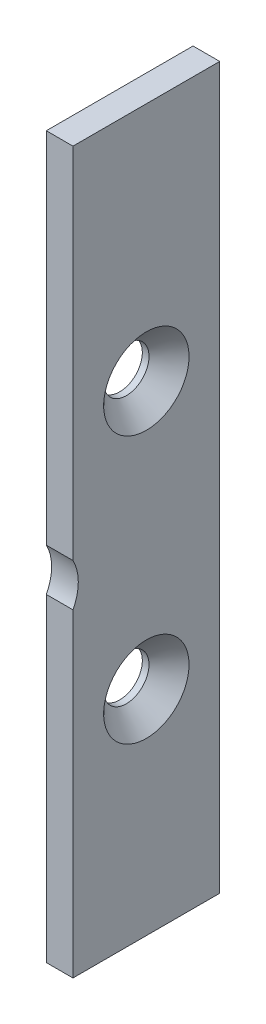
from build123d import *

# Parameters (mm, degrees)
END_STOP_SHEET_SKETCH_W                   = 2
END_STOP_SHEET_SKETCH_H                   = 54
END_STOP_SHEET_DEPTH                      = 11
SCREW_END_CLEARANCE_SKETCH_R              = 3.4
SCREW_END_CLEARANCE_DEPTH                 = 2.2
M3_COUNTERSUNK_CLEARANCE_1_BORE_PROFILE_R = 1.7
M3_COUNTERSUNK_CLEARANCE_1_BORE_DEPTH     = 2.2
M3_COUNTERSUNK_CLEARANCE_2_BORE_PROFILE_R = 1.7
M3_COUNTERSUNK_CLEARANCE_2_BORE_DEPTH     = 2.2


with BuildPart() as part:
    # End stop sheet sketch → End stop sheet (new body)
    with BuildSketch(Plane.XY.offset(-33.5)):
        with Locations((59.2, -27.5)):
            Rectangle(END_STOP_SHEET_SKETCH_W, END_STOP_SHEET_SKETCH_H)
    extrude(amount=END_STOP_SHEET_DEPTH)

    # Screw end clearance sketch → Screw end clearance (cut)
    with BuildSketch(Plane(origin=(58.1, 0, 0), x_dir=(0, 0, -1), z_dir=(1, 0, 0))):
        with Locations((19.5, -29)):
            Circle(SCREW_END_CLEARANCE_SKETCH_R)
    extrude(amount=SCREW_END_CLEARANCE_DEPTH, mode=Mode.SUBTRACT)

    # M3 countersunk clearance 1 bore profile → M3 countersunk clearance 1 bore (cut)
    with BuildSketch(Plane.ZY.offset(-60.2)):
        with Locations(Location((-28, -18.5, 0), (0, 0, 180))):
            Circle(M3_COUNTERSUNK_CLEARANCE_1_BORE_PROFILE_R)
    extrude(amount=M3_COUNTERSUNK_CLEARANCE_1_BORE_DEPTH, mode=Mode.SUBTRACT)

    # M3 countersunk clearance 1 countersink p → M3 countersunk clearance 1 countersink (revolve, cut)
    with BuildSketch(Plane.XY.offset(-28), mode=Mode.PRIVATE) as m3_countersunk_clearance_1_countersink_sk:
        Polygon((60.2, -18.5), (60.2, -15.3), (58.7, -16.8), (58.7, -18.5), align=None)
    revolve(m3_countersunk_clearance_1_countersink_sk.sketch.rotate(Axis((70.2, -18.5, -28), (-1, 0, 0)), 90), axis=Axis((70.2, -18.5, -28), (-1, 0, 0)), mode=Mode.SUBTRACT)

    # M3 countersunk clearance 2 bore profile → M3 countersunk clearance 2 bore (cut)
    with BuildSketch(Plane.ZY.offset(-60.2)):
        with Locations(Location((-28, -38.5, 0), (0, 0, 180))):
            Circle(M3_COUNTERSUNK_CLEARANCE_2_BORE_PROFILE_R)
    extrude(amount=M3_COUNTERSUNK_CLEARANCE_2_BORE_DEPTH, mode=Mode.SUBTRACT)

    # M3 countersunk clearance 2 countersink p → M3 countersunk clearance 2 countersink (revolve, cut)
    with BuildSketch(Plane.XY.offset(-28), mode=Mode.PRIVATE) as m3_countersunk_clearance_2_countersink_sk:
        Polygon((60.2, -38.5), (60.2, -35.3), (58.7, -36.8), (58.7, -38.5), align=None)
    revolve(m3_countersunk_clearance_2_countersink_sk.sketch.rotate(Axis((70.2, -38.5, -28), (-1, 0, 0)), 90), axis=Axis((70.2, -38.5, -28), (-1, 0, 0)), mode=Mode.SUBTRACT)


solid = part.part
